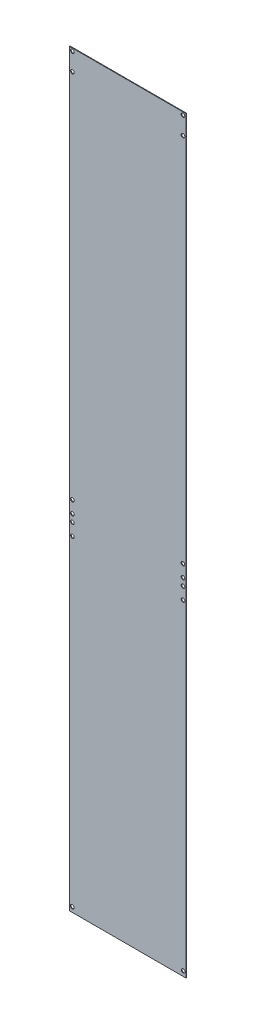
from build123d import *

# Parameters (mm, degrees)
SKETCH1_W           = 609.6
SKETCH1_H           = 3924.3
BOSS_EXTRUDE1_DEPTH = 3.175
SKETCH3_R           = 9.525
CUT_EXTRUDE2_DEPTH  = 3972.366607432


with BuildPart() as part:
    # Sketch1 → Boss-Extrude1 (new body)
    with BuildSketch(Plane.XY):
        with Locations((304.8, 1962.15)):
            Rectangle(SKETCH1_W, SKETCH1_H)
    extrude(amount=BOSS_EXTRUDE1_DEPTH)

    # Sketch3 → Cut-Extrude2 (cut, through all)
    with BuildSketch(Plane(origin=(0, 0, 0), x_dir=(-1, 0, 0), z_dir=(0, 0, -1))):
        with Locations((-594.51621, 3909.2505)):
            Circle(SKETCH3_R)
        with Locations((-594.51621, 3816.35)):
            Circle(SKETCH3_R)
        with Locations((-594.51621, 1873.24492)):
            Circle(SKETCH3_R)
        with Locations((-594.51621, 1809.75)):
            Circle(SKETCH3_R)
        with Locations((-594.51621, 1771.65)):
            Circle(SKETCH3_R)
        with Locations((-594.51621, 1708.16016)):
            Circle(SKETCH3_R)
        with Locations((-595.62492, 25.4)):
            Circle(SKETCH3_R)
        with Locations((-15.08379, 3909.2505)):
            Circle(SKETCH3_R)
        with Locations((-15.08379, 3816.35)):
            Circle(SKETCH3_R)
        with Locations((-15.08379, 1873.24492)):
            Circle(SKETCH3_R)
        with Locations((-15.08379, 1809.75)):
            Circle(SKETCH3_R)
        with Locations((-15.08379, 1771.65)):
            Circle(SKETCH3_R)
        with Locations((-15.08379, 1708.16016)):
            Circle(SKETCH3_R)
        with Locations((-13.97508, 25.4)):
            Circle(SKETCH3_R)
    extrude(amount=-CUT_EXTRUDE2_DEPTH, mode=Mode.SUBTRACT)


solid = part.part
